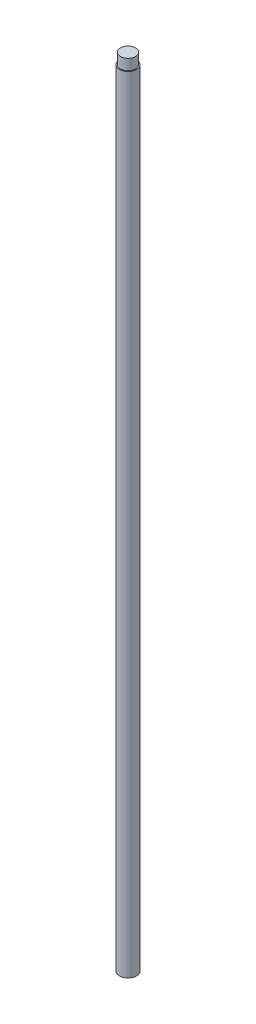
from build123d import *

# Parameters (mm, degrees)
ESQUISSE1_R        = 4
BOSS_EXTRU_1_DEPTH = 365
ESQUISSE2_R        = 3.5
BOSS_EXTRU_2_DEPTH = 5


with BuildPart() as part:
    # Esquisse1 → Boss.-Extru.1 (new body)
    with BuildSketch(Plane(origin=(0, 0, 0), x_dir=(1, 0, 0), z_dir=(0, 1, 0))):
        with Locations(Location((0, 0, 0), (0, 0, 90))):
            Circle(ESQUISSE1_R)
    extrude(amount=BOSS_EXTRU_1_DEPTH)

    # Esquisse2 → Boss.-Extru.2 (add)
    with BuildSketch(Plane(origin=(0, 365, 0), x_dir=(1, 0, 0), z_dir=(0, 1, 0))):
        with Locations(Location((0, 0, 0), (0, 0, 270))):
            Circle(ESQUISSE2_R)
    extrude(amount=BOSS_EXTRU_2_DEPTH)


solid = part.part
